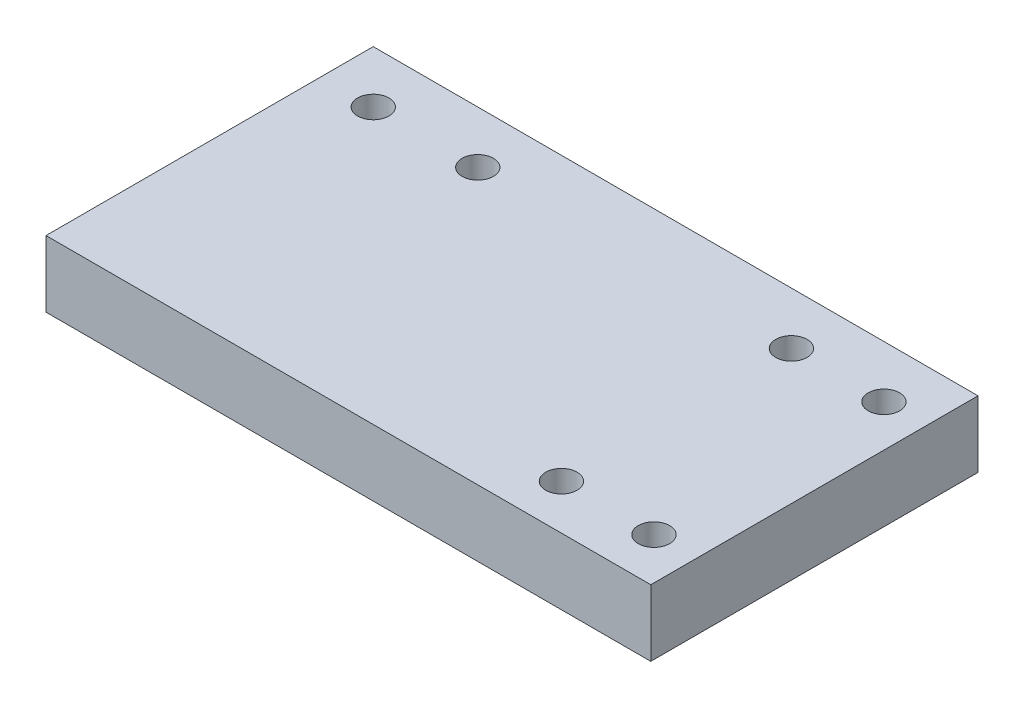
from build123d import *

# Parameters (mm, degrees)
SKETCH1_R           = 1.5
BOSS_EXTRUDE1_DEPTH = 6.35


with BuildPart() as part:
    # Sketch1 → Boss-Extrude1 (new body)
    with BuildSketch(Plane(origin=(0, 0, 0), x_dir=(1, 0, 0), z_dir=(0, 1, 0))):
        Polygon((0, 0), (49.85, 0), (57.85, 0), (57.85, 31.3), (49.85, 31.3), (0, 31.3), align=None)
        with Locations(Location((45, 26.3, 0), (0, 0, 270))):
            Circle(SKETCH1_R, mode=Mode.SUBTRACT)
        with Locations(Location((45, 4.3, 0), (0, 0, 270))):
            Circle(SKETCH1_R, mode=Mode.SUBTRACT)
        with Locations(Location((15, 26.3, 0), (0, 0, 270))):
            Circle(SKETCH1_R, mode=Mode.SUBTRACT)
        with Locations(Location((5, 26.3, 0), (0, 0, 270))):
            Circle(SKETCH1_R, mode=Mode.SUBTRACT)
        with Locations(Location((53.85, 26.3, 0), (0, 0, 270))):
            Circle(SKETCH1_R, mode=Mode.SUBTRACT)
        with Locations(Location((53.85, 4.3, 0), (0, 0, 270))):
            Circle(SKETCH1_R, mode=Mode.SUBTRACT)
    extrude(amount=BOSS_EXTRUDE1_DEPTH)


solid = part.part
